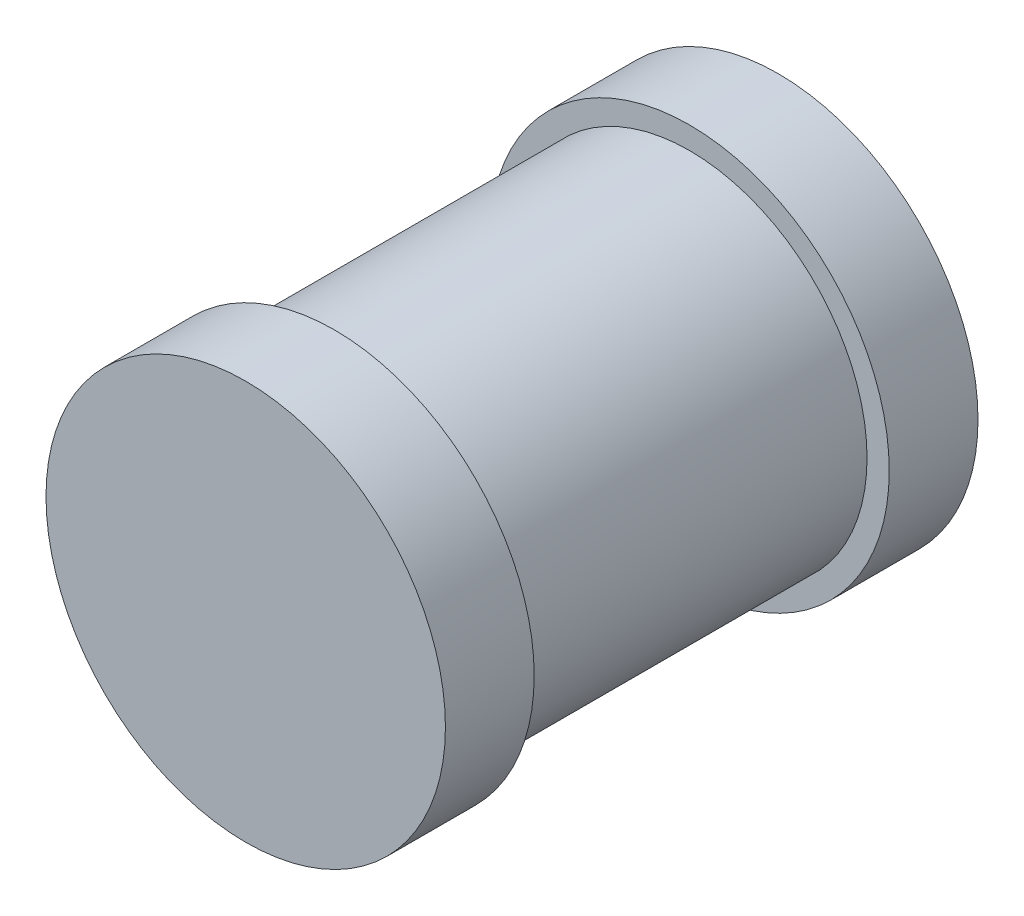
from build123d import *

# Parameters (mm, degrees)
SKETCH1_R           = 4
BOSS_EXTRUDE3_DEPTH = 8
SKETCH4_R           = 4.5
BOSS_EXTRUDE4_DEPTH = 2
BOSS_EXTRUDE5_START = 2
SKETCH5_R           = 4.5
BOSS_EXTRUDE5_DEPTH = 2


with BuildPart() as part:
    # Sketch1 → Boss-Extrude3 (new body)
    with BuildSketch(Plane.XY):
        Circle(SKETCH1_R)
    extrude(amount=BOSS_EXTRUDE3_DEPTH)

    # Sketch4 → Boss-Extrude4 (add)
    with BuildSketch(Plane.XY.offset(8)):
        Circle(SKETCH4_R)
    extrude(amount=BOSS_EXTRUDE4_DEPTH)

    # Sketch5 → Boss-Extrude5 (add)
    with BuildSketch(Plane(origin=(0, 0, 0), x_dir=(-1, 0, 0), z_dir=(0, 0, -1)).offset(BOSS_EXTRUDE5_START)):
        with Locations(Location((0, 0, 0), (0, 0, 180))):
            Circle(SKETCH5_R)
    extrude(amount=-BOSS_EXTRUDE5_DEPTH)


solid = part.part
